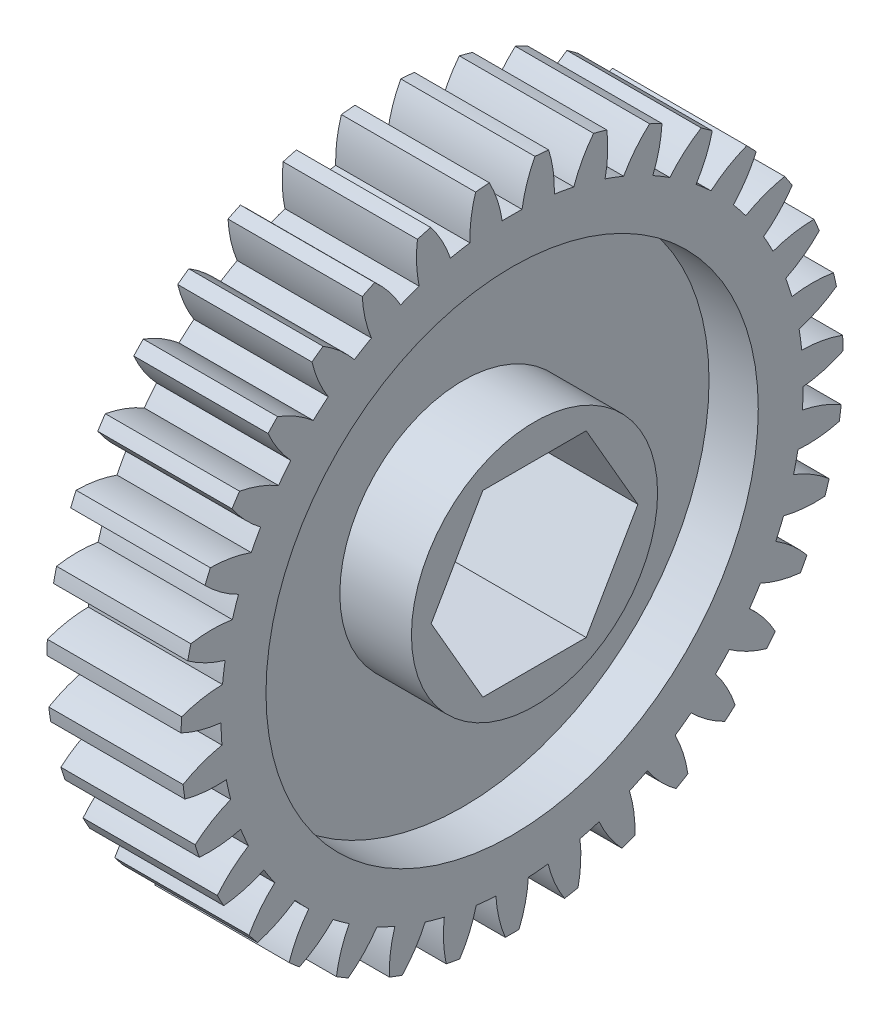
from build123d import *

# Parameters (mm, degrees)
SKETCH1_W                 = 9.525
SKETCH1_H                 = 23.495
CUT_EXTRUDE1_DEPTH        = 35.565237957
CUT_EXTRUDE2_DEPTH        = 35.565237957
CUT_EXTRUDE3_DEPTH        = 35.565237957
CUT_EXTRUDE4_DEPTH        = 35.565237957
CUT_EXTRUDE5_DEPTH        = 35.565237957
CUT_EXTRUDE6_DEPTH        = 35.565237957
CUT_EXTRUDE7_DEPTH        = 35.565237957
CUT_EXTRUDE8_DEPTH        = 35.565237957
CUT_EXTRUDE9_DEPTH        = 35.565237957
CUT_EXTRUDE10_DEPTH       = 35.565237957
CUT_EXTRUDE11_DEPTH       = 35.565237957
CUT_EXTRUDE12_DEPTH       = 35.565237957
CUT_EXTRUDE13_DEPTH       = 35.565237957
CUT_EXTRUDE14_DEPTH       = 35.565237957
CUT_EXTRUDE15_DEPTH       = 35.565237957
CUT_EXTRUDE16_DEPTH       = 35.565237957
CUT_EXTRUDE17_DEPTH       = 35.565237957
CUT_EXTRUDE18_DEPTH       = 35.565237957
CUT_EXTRUDE19_DEPTH       = 35.565237957
CUT_EXTRUDE20_DEPTH       = 35.565237957
CUT_EXTRUDE21_DEPTH       = 35.565237957
CUT_EXTRUDE22_DEPTH       = 35.565237957
CUT_EXTRUDE23_DEPTH       = 35.565237957
CUT_EXTRUDE24_DEPTH       = 35.565237957
CUT_EXTRUDE25_DEPTH       = 35.565237957
CUT_EXTRUDE26_DEPTH       = 35.565237957
CUT_EXTRUDE27_DEPTH       = 35.565237957
CUT_EXTRUDE28_DEPTH       = 35.565237957
CUT_EXTRUDE29_DEPTH       = 35.56057735
CUT_EXTRUDE30_DEPTH       = 35.56057735
CUT_EXTRUDE31_DEPTH       = 35.56057735
CUT_EXTRUDE32_DEPTH       = 35.56057735
CUT_EXTRUDE33_DEPTH       = 35.56057735
CUT_EXTRUDE34_DEPTH       = 35.56057735
CUT_EXTRUDE35_DEPTH       = 35.56057735
M30_CLEARANCE_HOLE1_D     = 34.925
M30_CLEARANCE_HOLE1_DEPTH = 3.4925
SKETCH39_R                = 8.73125
BOSS_EXTRUDE1_DEPTH       = 5.08
M30_CLEARANCE_HOLE2_D     = 34.925
M30_CLEARANCE_HOLE2_DEPTH = 3.4925
BOSS_EXTRUDE2_START       = 5.08
SKETCH42_R                = 8.73125
BOSS_EXTRUDE2_DEPTH       = 5.08
CUT_EXTRUDE36_DEPTH       = 36.56680871


with BuildPart() as part:
    # Sketch1 → Revolve1 (revolve)
    with BuildSketch(Plane(origin=(0, 0, 0), x_dir=(-1, 0, 0), z_dir=(0, 0, -1)), mode=Mode.PRIVATE) as revolve1_sk:
        with Locations((-4.7625, 11.7475)):
            Rectangle(SKETCH1_W, SKETCH1_H)
    revolve(revolve1_sk.sketch.rotate(Axis((9.525, 0, 0), (-1, 0, 0)), 270), axis=Axis((9.525, 0, 0), (-1, 0, 0)))

    # Sketch2 → Cut-Extrude1 (cut, through all)
    with BuildSketch(Plane.ZY):
        with BuildLine():
            ThreePointArc((-2.590428395, 23.351760228), (-4.195194243, 23.117425684), (-5.779971249, 22.772943537))
            ThreePointArc((-5.779971249, 22.772943537), (-4.97040512, 21.535490677), (-4.377161004, 20.18096186))
            ThreePointArc((-4.377161004, 20.18096186), (-3.687235589, 20.31834279), (-2.993031157, 20.432144394))
            ThreePointArc((-2.993031157, 20.432144394), (-2.913562654, 21.908752553), (-2.590428395, 23.351760228))
        make_face()
    extrude(amount=-CUT_EXTRUDE1_DEPTH, mode=Mode.SUBTRACT)

    # Sketch3 → Cut-Extrude2 (cut, through all)
    with BuildSketch(Plane.ZY):
        with BuildLine():
            ThreePointArc((1.62081865, 23.439026684), (0, 23.495), (-1.62081865, 23.439026684))
            ThreePointArc((-1.62081865, 23.439026684), (-1.045218321, 22.076906587), (-0.703368342, 20.638217777))
            ThreePointArc((-0.703368342, 20.638217777), (0, 20.6502), (0.703368342, 20.638217777))
            ThreePointArc((0.703368342, 20.638217777), (1.045218321, 22.076906587), (1.62081865, 23.439026684))
        make_face()
    extrude(amount=-CUT_EXTRUDE2_DEPTH, mode=Mode.SUBTRACT)

    # Sketch4 → Cut-Extrude3 (cut, through all)
    with BuildSketch(Plane.ZY):
        with BuildLine():
            ThreePointArc((5.779971249, 22.772943537), (4.195194243, 23.117425684), (2.590428395, 23.351760228))
            ThreePointArc((2.590428395, 23.351760228), (2.913562654, 21.908752553), (2.993031157, 20.432144394))
            ThreePointArc((2.993031157, 20.432144394), (3.687235589, 20.31834279), (4.377161004, 20.18096186))
            ThreePointArc((4.377161004, 20.18096186), (4.97040512, 21.535490677), (5.779971249, 22.772943537))
        make_face()
    extrude(amount=-CUT_EXTRUDE3_DEPTH, mode=Mode.SUBTRACT)

    # Sketch5 → Cut-Extrude4 (cut, through all)
    with BuildSketch(Plane.ZY):
        with BuildLine():
            ThreePointArc((9.753350817, 21.374919248), (8.255551492, 21.996838286), (6.718416939, 22.513948984))
            ThreePointArc((6.718416939, 22.513948984), (6.778699328, 21.036433186), (6.593232172, 19.569365078))
            ThreePointArc((6.593232172, 19.569365078), (7.255960392, 19.333437326), (7.91026811, 19.075073223))
            ThreePointArc((7.91026811, 19.075073223), (8.735839008, 20.301906378), (9.753350817, 21.374919248))
        make_face()
    extrude(amount=-CUT_EXTRUDE4_DEPTH, mode=Mode.SUBTRACT)

    # Sketch6 → Cut-Extrude5 (cut, through all)
    with BuildSketch(Plane.ZY):
        with BuildLine():
            ThreePointArc((13.413249664, 19.289887466), (12.050568523, 20.169254406), (10.630470035, 20.952520894))
            ThreePointArc((10.630470035, 20.952520894), (10.425963029, 19.487985547), (9.98152128, 18.077610267))
            ThreePointArc((9.98152128, 18.077610267), (10.591472658, 17.727139278), (11.18913269, 17.356096038))
            ThreePointArc((11.18913269, 17.356096038), (12.220495842, 18.415802104), (13.413249664, 19.289887466))
        make_face()
    extrude(amount=-CUT_EXTRUDE5_DEPTH, mode=Mode.SUBTRACT)

    # Sketch7 → Cut-Extrude6 (cut, through all)
    with BuildSketch(Plane.ZY):
        with BuildLine():
            ThreePointArc((16.64203563, 16.58486283), (15.458270366, 17.693414094), (14.200851077, 18.717661544))
            ThreePointArc((14.200851077, 18.717661544), (13.738127699, 17.313178019), (13.048996081, 16.004826188))
            ThreePointArc((13.048996081, 16.004826188), (13.586566278, 15.551076387), (14.108369338, 15.079279646))
            ThreePointArc((14.108369338, 15.079279646), (15.312375886, 15.937798797), (16.64203563, 16.58486283))
        make_face()
    extrude(amount=-CUT_EXTRUDE6_DEPTH, mode=Mode.SUBTRACT)

    # Sketch8 → Cut-Extrude7 (cut, through all)
    with BuildSketch(Plane.ZY):
        with BuildLine():
            ThreePointArc((19.335932879, 13.346787056), (18.369130681, 14.648892895), (17.314805082, 15.881201151))
            ThreePointArc((17.314805082, 15.881201151), (16.608737641, 14.581910703), (15.697065412, 13.417633826))
            ThreePointArc((15.697065412, 13.417633826), (16.144976479, 12.875189106), (16.574151388, 12.317802799))
            ThreePointArc((16.574151388, 12.317802799), (17.912103569, 12.947541524), (19.335932879, 13.346787056))
        make_face()
    extrude(amount=-CUT_EXTRUDE7_DEPTH, mode=Mode.SUBTRACT)

    # Sketch9 → Cut-Extrude8 (cut, through all)
    with BuildSketch(Plane.ZY):
        with BuildLine():
            ThreePointArc((21.408357335, 9.679734564), (20.689592021, 11.133544225), (19.872247004, 12.534305885))
            ThreePointArc((19.872247004, 12.534305885), (18.945529089, 11.381968779), (17.840618145, 10.399187673))
            ThreePointArc((17.840618145, 10.399187673), (18.184473852, 9.785482654), (18.507226575, 9.160421635))
            ThreePointArc((18.507226575, 9.160421635), (19.936121505, 9.541139612), (21.408357335, 9.679734564))
        make_face()
    extrude(amount=-CUT_EXTRUDE8_DEPTH, mode=Mode.SUBTRACT)

    # Sketch10 → Cut-Extrude9 (cut, through all)
    with BuildSketch(Plane.ZY):
        with BuildLine():
            ThreePointArc((22.792699571, 5.701567439), (22.34507285, 7.260354283), (21.790978556, 8.784547715))
            ThreePointArc((21.790978556, 8.784547715), (20.673395645, 7.816201014), (19.410758731, 7.046503072))
            ThreePointArc((19.410758731, 7.046503072), (19.639507273, 6.381262737), (19.845464273, 5.708616982))
            ThreePointArc((19.845464273, 5.708616982), (21.319376093, 5.828077623), (22.792699571, 5.701567439))
        make_face()
    extrude(amount=-CUT_EXTRUDE9_DEPTH, mode=Mode.SUBTRACT)

    # Sketch11 → Cut-Extrude10 (cut, through all)
    with BuildSketch(Plane.ZY):
        with BuildLine():
            ThreePointArc((23.444465689, 1.540147245), (23.282364653, 3.15381058), (23.009330128, 4.752446954))
            ThreePointArc((23.009330128, 4.752446954), (21.736802254, 3.999214117), (20.35702156, 3.467338064))
            ThreePointArc((20.35702156, 3.467338064), (20.46331077, 2.771943786), (20.545852419, 2.073332682))
            ThreePointArc((20.545852419, 2.073332682), (22.017408391, 1.927696424), (23.444465689, 1.540147245))
        make_face()
    extrude(amount=-CUT_EXTRUDE10_DEPTH, mode=Mode.SUBTRACT)

    # Sketch12 → Cut-Extrude11 (cut, through all)
    with BuildSketch(Plane.ZY):
        with BuildLine():
            ThreePointArc((23.34270739, -2.670774549), (23.471342098, -1.054099189), (23.488142898, 0.567598637))
            ThreePointArc((23.488142898, 0.567598637), (22.101570153, 0.053689187), (20.648992966, -0.223270042))
            ThreePointArc((20.648992966, -0.223270042), (20.629406623, -0.92646772), (20.585879964, -1.628590236))
            ThreePointArc((20.585879964, -1.628590236), (22.007783068, -2.034642525), (23.34270739, -2.670774549))
        make_face()
    extrude(amount=-CUT_EXTRUDE11_DEPTH, mode=Mode.SUBTRACT)

    # Sketch13 → Cut-Extrude12 (cut, through all)
    with BuildSketch(Plane.ZY):
        with BuildLine():
            ThreePointArc((22.490695269, -6.795855451), (22.905931297, -5.228129343), (23.212027429, -3.635492767))
            ThreePointArc((23.212027429, -3.635492767), (21.755975403, -3.893561357), (20.277288749, -3.906702066))
            ThreePointArc((20.277288749, -3.906702066), (20.132456372, -4.59510179), (19.964260388, -5.278168924))
            ThreePointArc((19.964260388, -5.278168924), (21.290809489, -5.931586388), (22.490695269, -6.795855451))
        make_face()
    extrude(amount=-CUT_EXTRUDE12_DEPTH, mode=Mode.SUBTRACT)

    # Sketch14 → Cut-Extrude13 (cut, through all)
    with BuildSketch(Plane.ZY):
        with BuildLine():
            ThreePointArc((20.915813697, -10.702511967), (21.604305016, -9.234123119), (22.189858299, -7.721736442))
            ThreePointArc((22.189858299, -7.721736442), (20.711125702, -7.715669635), (19.253855787, -7.46456947))
            ThreePointArc((19.253855787, -7.46456947), (18.988432409, -8.116045509), (18.700973057, -8.75810292))
            ThreePointArc((18.700973057, -8.75810292), (19.889531775, -9.637884185), (20.915813697, -10.702511967))
        make_face()
    extrude(amount=-CUT_EXTRUDE13_DEPTH, mode=Mode.SUBTRACT)

    # Sketch15 → Cut-Extrude14 (cut, through all)
    with BuildSketch(Plane.ZY):
        with BuildLine():
            ThreePointArc((18.668680662, -14.265180943), (19.608298596, -12.943324579), (20.454488865, -11.559797154))
            ThreePointArc((20.454488865, -11.559797154), (19.00060338, -11.289789943), (17.611588058, -10.78251947))
            ThreePointArc((17.611588058, -10.78251947), (17.234104604, -11.376132846), (16.836621065, -11.956544282))
            ThreePointArc((16.836621065, -11.956544282), (17.848988144, -13.034412453), (18.668680662, -14.265180943))
        make_face()
    extrude(amount=-CUT_EXTRUDE14_DEPTH, mode=Mode.SUBTRACT)

    # Sketch16 → Cut-Extrude15 (cut, through all)
    with BuildSketch(Plane.ZY):
        with BuildLine():
            ThreePointArc((15.821520871, -17.369355265), (16.982065326, -16.236516938), (18.06169533, -15.026316475))
            ThreePointArc((18.06169533, -15.026316475), (16.679386032, -14.501047113), (15.403269398, -13.753910422))
            ThreePointArc((15.403269398, -13.753910422), (14.925858497, -14.270581914), (14.431126218, -14.770692472))
            ThreePointArc((14.431126218, -14.770692472), (15.234763348, -16.012003981), (15.821520871, -17.369355265))
        make_face()
    extrude(amount=-CUT_EXTRUDE15_DEPTH, mode=Mode.SUBTRACT)

    # Sketch17 → Cut-Extrude16 (cut, through all)
    with BuildSketch(Plane.ZY):
        with BuildLine():
            ThreePointArc((12.465844381, -19.915264218), (13.810014503, -19.007854283), (15.088384045, -18.00987762))
            ThreePointArc((15.088384045, -18.00987762), (13.822079492, -17.246228697), (12.699876985, -16.283239377))
            ThreePointArc((12.699876985, -16.283239377), (12.137883017, -16.706362737), (11.561803101, -17.110098454))
            ThreePointArc((11.561803101, -17.110098454), (12.130880723, -18.474956526), (12.465844381, -19.915264218))
        make_face()
    extrude(amount=-CUT_EXTRUDE16_DEPTH, mode=Mode.SUBTRACT)

    # Sketch18 → Cut-Extrude17 (cut, through all)
    with BuildSketch(Plane.ZY):
        with BuildLine():
            ThreePointArc((8.709505395, -21.821080193), (10.194098451, -21.168263551), (11.630119683, -20.41458648))
            ThreePointArc((11.630119683, -20.41458648), (10.520519945, -19.437102301), (9.588300077, -18.28921162))
            ThreePointArc((9.588300077, -18.28921162), (8.95978599, -18.605187316), (8.320874119, -18.899571792))
            ThreePointArc((8.320874119, -18.899571792), (8.63710161, -20.344108767), (8.709505395, -21.821080193))
        make_face()
    extrude(amount=-CUT_EXTRUDE17_DEPTH, mode=Mode.SUBTRACT)

    # Sketch19 → Cut-Extrude18 (cut, through all)
    with BuildSketch(Plane.ZY):
        with BuildLine():
            ThreePointArc((4.67323574, -23.025548695), (6.250535687, -22.648307412), (7.798053704, -22.163153734))
            ThreePointArc((7.798053704, -22.163153734), (6.880822231, -21.003251443), (6.168547315, -19.707353553))
            ThreePointArc((6.168547315, -19.707353553), (5.493714068, -19.906025866), (4.812505396, -20.081597343))
            ThreePointArc((4.812505396, -20.081597343), (4.865718945, -21.559384614), (4.67323574, -23.025548695))
        make_face()
    extrude(amount=-CUT_EXTRUDE18_DEPTH, mode=Mode.SUBTRACT)

    # Sketch20 → Cut-Extrude19 (cut, through all)
    with BuildSketch(Plane.ZY):
        with BuildLine():
            ThreePointArc((0.486764443, -23.489957117), (2.106075563, -23.400416037), (3.715351864, -23.19937899))
            ThreePointArc((3.715351864, -23.19937899), (3.019969229, -21.894338803), (2.550532366, -20.492084928))
            ThreePointArc((2.550532366, -20.492084928), (1.851069657, -20.567068366), (1.149458791, -20.618183832))
            ThreePointArc((1.149458791, -20.618183832), (0.93794807, -22.081724099), (0.486764443, -23.489957117))
        make_face()
    extrude(amount=-CUT_EXTRUDE19_DEPTH, mode=Mode.SUBTRACT)

    # Sketch21 → Cut-Extrude20 (cut, through all)
    with BuildSketch(Plane.ZY):
        with BuildLine():
            ThreePointArc((-3.715351864, -23.19937899), (-2.106075563, -23.400416037), (-0.486764443, -23.489957117))
            ThreePointArc((-0.486764443, -23.489957117), (-0.93794807, -22.081724099), (-1.149458791, -20.618183832))
            ThreePointArc((-1.149458791, -20.618183832), (-1.851069657, -20.567068366), (-2.550532366, -20.492084928))
            ThreePointArc((-2.550532366, -20.492084928), (-3.019969229, -21.894338803), (-3.715351864, -23.19937899))
        make_face()
    extrude(amount=-CUT_EXTRUDE20_DEPTH, mode=Mode.SUBTRACT)

    # Sketch22 → Cut-Extrude21 (cut, through all)
    with BuildSketch(Plane.ZY):
        with BuildLine():
            ThreePointArc((-7.798053704, -22.163153734), (-6.250535687, -22.648307412), (-4.67323574, -23.025548695))
            ThreePointArc((-4.67323574, -23.025548695), (-4.865718945, -21.559384614), (-4.812505396, -20.081597343))
            ThreePointArc((-4.812505396, -20.081597343), (-5.493714068, -19.906025866), (-6.168547315, -19.707353553))
            ThreePointArc((-6.168547315, -19.707353553), (-6.880822231, -21.003251443), (-7.798053704, -22.163153734))
        make_face()
    extrude(amount=-CUT_EXTRUDE21_DEPTH, mode=Mode.SUBTRACT)

    # Sketch23 → Cut-Extrude22 (cut, through all)
    with BuildSketch(Plane.ZY):
        with BuildLine():
            ThreePointArc((-11.630119683, -20.41458648), (-10.194098451, -21.168263551), (-8.709505395, -21.821080193))
            ThreePointArc((-8.709505395, -21.821080193), (-8.63710161, -20.344108767), (-8.320874119, -18.899571792))
            ThreePointArc((-8.320874119, -18.899571792), (-8.95978599, -18.605187316), (-9.588300077, -18.28921162))
            ThreePointArc((-9.588300077, -18.28921162), (-10.520519945, -19.437102301), (-11.630119683, -20.41458648))
        make_face()
    extrude(amount=-CUT_EXTRUDE22_DEPTH, mode=Mode.SUBTRACT)

    # Sketch24 → Cut-Extrude23 (cut, through all)
    with BuildSketch(Plane.ZY):
        with BuildLine():
            ThreePointArc((-15.088384045, -18.00987762), (-13.810014503, -19.007854283), (-12.465844381, -19.915264218))
            ThreePointArc((-12.465844381, -19.915264218), (-12.130880723, -18.474956526), (-11.561803101, -17.110098454))
            ThreePointArc((-11.561803101, -17.110098454), (-12.137883017, -16.706362737), (-12.699876985, -16.283239377))
            ThreePointArc((-12.699876985, -16.283239377), (-13.822079492, -17.246228697), (-15.088384045, -18.00987762))
        make_face()
    extrude(amount=-CUT_EXTRUDE23_DEPTH, mode=Mode.SUBTRACT)

    # Sketch25 → Cut-Extrude24 (cut, through all)
    with BuildSketch(Plane.ZY):
        with BuildLine():
            ThreePointArc((-18.06169533, -15.026316475), (-16.982065326, -16.236516938), (-15.821520871, -17.369355265))
            ThreePointArc((-15.821520871, -17.369355265), (-15.234763348, -16.012003981), (-14.431126218, -14.770692472))
            ThreePointArc((-14.431126218, -14.770692472), (-14.925858497, -14.270581914), (-15.403269398, -13.753910422))
            ThreePointArc((-15.403269398, -13.753910422), (-16.679386032, -14.501047113), (-18.06169533, -15.026316475))
        make_face()
    extrude(amount=-CUT_EXTRUDE24_DEPTH, mode=Mode.SUBTRACT)

    # Sketch26 → Cut-Extrude25 (cut, through all)
    with BuildSketch(Plane.ZY):
        with BuildLine():
            ThreePointArc((-20.454488865, -11.559797154), (-19.608298596, -12.943324579), (-18.668680662, -14.265180943))
            ThreePointArc((-18.668680662, -14.265180943), (-17.848988144, -13.034412453), (-16.836621065, -11.956544282))
            ThreePointArc((-16.836621065, -11.956544282), (-17.234104604, -11.376132846), (-17.611588058, -10.78251947))
            ThreePointArc((-17.611588058, -10.78251947), (-19.00060338, -11.289789943), (-20.454488865, -11.559797154))
        make_face()
    extrude(amount=-CUT_EXTRUDE25_DEPTH, mode=Mode.SUBTRACT)

    # Sketch27 → Cut-Extrude26 (cut, through all)
    with BuildSketch(Plane.ZY):
        with BuildLine():
            ThreePointArc((-22.189858299, -7.721736442), (-21.604305016, -9.234123119), (-20.915813697, -10.702511967))
            ThreePointArc((-20.915813697, -10.702511967), (-19.889531775, -9.637884185), (-18.700973057, -8.75810292))
            ThreePointArc((-18.700973057, -8.75810292), (-18.988432409, -8.116045509), (-19.253855787, -7.46456947))
            ThreePointArc((-19.253855787, -7.46456947), (-20.711125702, -7.715669635), (-22.189858299, -7.721736442))
        make_face()
    extrude(amount=-CUT_EXTRUDE26_DEPTH, mode=Mode.SUBTRACT)

    # Sketch28 → Cut-Extrude27 (cut, through all)
    with BuildSketch(Plane.ZY):
        with BuildLine():
            ThreePointArc((-23.212027429, -3.635492767), (-22.905931297, -5.228129343), (-22.490695269, -6.795855451))
            ThreePointArc((-22.490695269, -6.795855451), (-21.290809489, -5.931586388), (-19.964260388, -5.278168924))
            ThreePointArc((-19.964260388, -5.278168924), (-20.132456372, -4.59510179), (-20.277288749, -3.906702066))
            ThreePointArc((-20.277288749, -3.906702066), (-21.755975403, -3.893561357), (-23.212027429, -3.635492767))
        make_face()
    extrude(amount=-CUT_EXTRUDE27_DEPTH, mode=Mode.SUBTRACT)

    # Sketch29 → Cut-Extrude28 (cut, through all)
    with BuildSketch(Plane.ZY):
        with BuildLine():
            ThreePointArc((-23.488142898, 0.567598637), (-23.471342098, -1.054099189), (-23.34270739, -2.670774549))
            ThreePointArc((-23.34270739, -2.670774549), (-22.007783068, -2.034642525), (-20.585879964, -1.628590236))
            ThreePointArc((-20.585879964, -1.628590236), (-20.629406623, -0.92646772), (-20.648992966, -0.223270042))
            ThreePointArc((-20.648992966, -0.223270042), (-22.101570153, 0.053689187), (-23.488142898, 0.567598637))
        make_face()
    extrude(amount=-CUT_EXTRUDE28_DEPTH, mode=Mode.SUBTRACT)

    # Sketch30 → Cut-Extrude29 (cut, through all)
    with BuildSketch(Plane.ZY):
        with BuildLine():
            ThreePointArc((-23.009330128, 4.752446954), (-23.282364653, 3.15381058), (-23.444465689, 1.540147245))
            ThreePointArc((-23.444465689, 1.540147245), (-22.017408391, 1.927696424), (-20.545852419, 2.073332682))
            ThreePointArc((-20.545852419, 2.073332682), (-20.46331077, 2.771943786), (-20.35702156, 3.467338064))
            ThreePointArc((-20.35702156, 3.467338064), (-21.736802254, 3.999214117), (-23.009330128, 4.752446954))
        make_face()
    extrude(amount=-CUT_EXTRUDE29_DEPTH, mode=Mode.SUBTRACT)

    # Sketch31 → Cut-Extrude30 (cut, through all)
    with BuildSketch(Plane.ZY):
        with BuildLine():
            ThreePointArc((-21.790978556, 8.784547715), (-22.34507285, 7.260354283), (-22.792699571, 5.701567439))
            ThreePointArc((-22.792699571, 5.701567439), (-21.319376093, 5.828077623), (-19.845464273, 5.708616982))
            ThreePointArc((-19.845464273, 5.708616982), (-19.639507273, 6.381262737), (-19.410758731, 7.046503072))
            ThreePointArc((-19.410758731, 7.046503072), (-20.673395645, 7.816201014), (-21.790978556, 8.784547715))
        make_face()
    extrude(amount=-CUT_EXTRUDE30_DEPTH, mode=Mode.SUBTRACT)

    # Sketch32 → Cut-Extrude31 (cut, through all)
    with BuildSketch(Plane.ZY):
        with BuildLine():
            ThreePointArc((-19.872247004, 12.534305885), (-20.689592021, 11.133544225), (-21.408357335, 9.679734564))
            ThreePointArc((-21.408357335, 9.679734564), (-19.936121505, 9.541139612), (-18.507226575, 9.160421635))
            ThreePointArc((-18.507226575, 9.160421635), (-18.184473852, 9.785482654), (-17.840618145, 10.399187673))
            ThreePointArc((-17.840618145, 10.399187673), (-18.945529089, 11.381968779), (-19.872247004, 12.534305885))
        make_face()
    extrude(amount=-CUT_EXTRUDE31_DEPTH, mode=Mode.SUBTRACT)

    # Sketch33 → Cut-Extrude32 (cut, through all)
    with BuildSketch(Plane.ZY):
        with BuildLine():
            ThreePointArc((-17.314805082, 15.881201151), (-18.369130681, 14.648892895), (-19.335932879, 13.346787056))
            ThreePointArc((-19.335932879, 13.346787056), (-17.912103569, 12.947541524), (-16.574151388, 12.317802799))
            ThreePointArc((-16.574151388, 12.317802799), (-16.144976479, 12.875189106), (-15.697065412, 13.417633826))
            ThreePointArc((-15.697065412, 13.417633826), (-16.608737641, 14.581910703), (-17.314805082, 15.881201151))
        make_face()
    extrude(amount=-CUT_EXTRUDE32_DEPTH, mode=Mode.SUBTRACT)

    # Sketch34 → Cut-Extrude33 (cut, through all)
    with BuildSketch(Plane.ZY):
        with BuildLine():
            ThreePointArc((-14.200851077, 18.717661544), (-15.458270366, 17.693414094), (-16.64203563, 16.58486283))
            ThreePointArc((-16.64203563, 16.58486283), (-15.312375886, 15.937798797), (-14.108369338, 15.079279646))
            ThreePointArc((-14.108369338, 15.079279646), (-13.586566278, 15.551076387), (-13.048996081, 16.004826188))
            ThreePointArc((-13.048996081, 16.004826188), (-13.738127699, 17.313178019), (-14.200851077, 18.717661544))
        make_face()
    extrude(amount=-CUT_EXTRUDE33_DEPTH, mode=Mode.SUBTRACT)

    # Sketch35 → Cut-Extrude34 (cut, through all)
    with BuildSketch(Plane.ZY):
        with BuildLine():
            ThreePointArc((-10.630470035, 20.952520894), (-12.050568523, 20.169254406), (-13.413249664, 19.289887466))
            ThreePointArc((-13.413249664, 19.289887466), (-12.220495842, 18.415802104), (-11.18913269, 17.356096038))
            ThreePointArc((-11.18913269, 17.356096038), (-10.591472658, 17.727139278), (-9.98152128, 18.077610267))
            ThreePointArc((-9.98152128, 18.077610267), (-10.425963029, 19.487985547), (-10.630470035, 20.952520894))
        make_face()
    extrude(amount=-CUT_EXTRUDE34_DEPTH, mode=Mode.SUBTRACT)

    # Sketch36 → Cut-Extrude35 (cut, through all)
    with BuildSketch(Plane.ZY):
        with BuildLine():
            ThreePointArc((-6.718416939, 22.513948984), (-8.255551492, 21.996838286), (-9.753350817, 21.374919248))
            ThreePointArc((-9.753350817, 21.374919248), (-8.735839008, 20.301906378), (-7.91026811, 19.075073223))
            ThreePointArc((-7.91026811, 19.075073223), (-7.255960392, 19.333437326), (-6.593232172, 19.569365078))
            ThreePointArc((-6.593232172, 19.569365078), (-6.778699328, 21.036433186), (-6.718416939, 22.513948984))
        make_face()
    extrude(amount=-CUT_EXTRUDE35_DEPTH, mode=Mode.SUBTRACT)

    # M30 Clearance Hole1
    with Locations(Plane(origin=(9.525, 0, 0), x_dir=(0, 0, -1), z_dir=(1, 0, 0))):
        with Locations((0, 0)):
            Hole(M30_CLEARANCE_HOLE1_D / 2, depth=M30_CLEARANCE_HOLE1_DEPTH)

    # Sketch39 → Boss-Extrude1 (add)
    with BuildSketch(Plane(origin=(6.0325, 0, 0), x_dir=(0, 0, -1), z_dir=(1, 0, 0))):
        with Locations(Location((0, 0, 0), (0, 0, 180))):
            Circle(SKETCH39_R)
    extrude(amount=BOSS_EXTRUDE1_DEPTH)

    # M30 Clearance Hole2
    with Locations(Plane.ZY):
        with Locations((0, 0)):
            Hole(M30_CLEARANCE_HOLE2_D / 2, depth=M30_CLEARANCE_HOLE2_DEPTH)

    # Sketch42 → Boss-Extrude2 (add)
    with BuildSketch(Plane.ZY.offset(-3.4925).offset(BOSS_EXTRUDE2_START)):
        Circle(SKETCH42_R)
    extrude(amount=-BOSS_EXTRUDE2_DEPTH)

    # Sketch43 → Cut-Extrude36 (cut, through all)
    with BuildSketch(Plane.ZY.offset(1.5875)):
        Polygon((-3.666174209, -6.35), (3.666174209, -6.35), (7.332348419, 0), (3.666174209, 6.35), (-3.666174209, 6.35), (-7.332348419, 0), align=None)
    extrude(amount=-CUT_EXTRUDE36_DEPTH, mode=Mode.SUBTRACT)


solid = part.part
